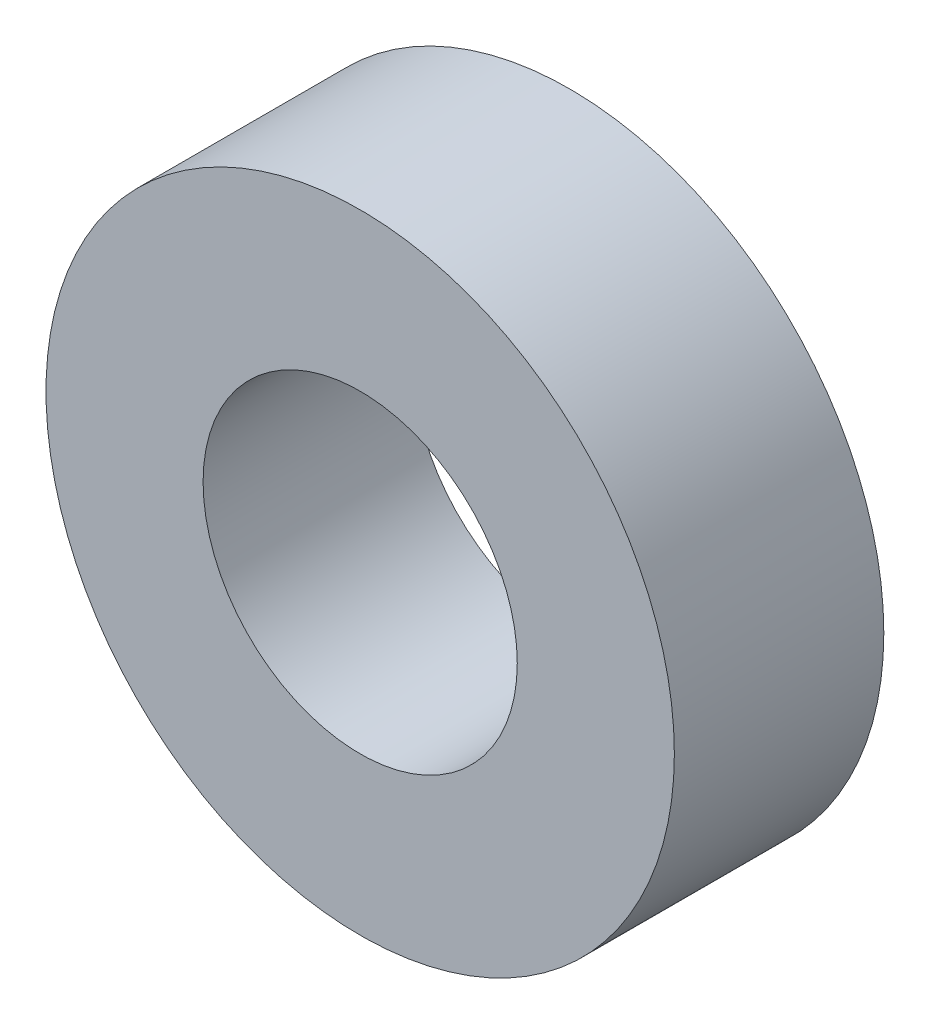
from build123d import *

# Parameters (mm, degrees)
SKETCH5_R           = 19.05
SKETCH5_R_2         = 9.525
BOSS_EXTRUDE3_DEPTH = 12.7


with BuildPart() as part:
    # Sketch5 → Boss-Extrude3 (new body)
    with BuildSketch(Plane.XY):
        Circle(SKETCH5_R)
        Circle(SKETCH5_R_2, mode=Mode.SUBTRACT)
    extrude(amount=BOSS_EXTRUDE3_DEPTH)


solid = part.part
